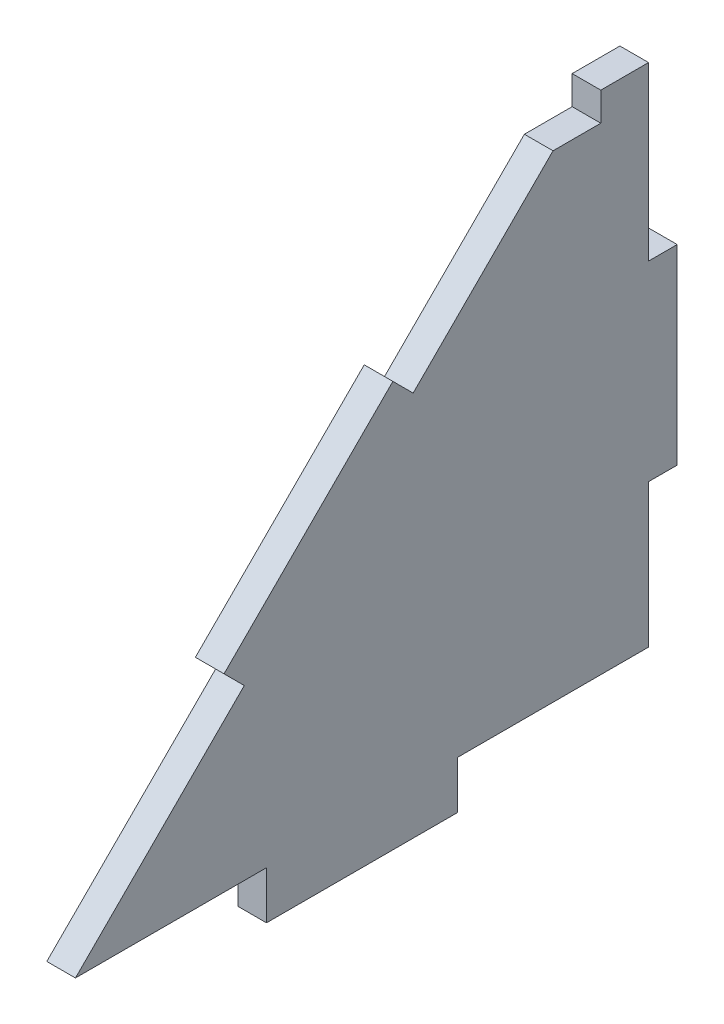
from build123d import *

# Parameters (mm, degrees)
EXTRUDE_1_DEPTH = 3


with BuildPart() as part:
    # 스케치1 → 보스-돌출1 (new body)
    with BuildSketch(Plane(origin=(0, 0, 0), x_dir=(0, 0, -1), z_dir=(1, 0, 0))):
        Polygon((51.8, 32), (51.8, 47), (51.8, 50), (46.8, 50), (46.8, 47), (41.8, 47), (27.155339059, 32.355339059), (25.034018716, 34.476659403), (7.356349186, 16.798989873), (9.47766953, 14.67766953), (-8.2, -3), (11.8, -3), (11.8, -8), (31.8, -8), (31.8, -3), (51.8, -3), (51.8, 12), (54.8, 12), (54.8, 32), align=None)
    extrude(amount=EXTRUDE_1_DEPTH)


solid = part.part
